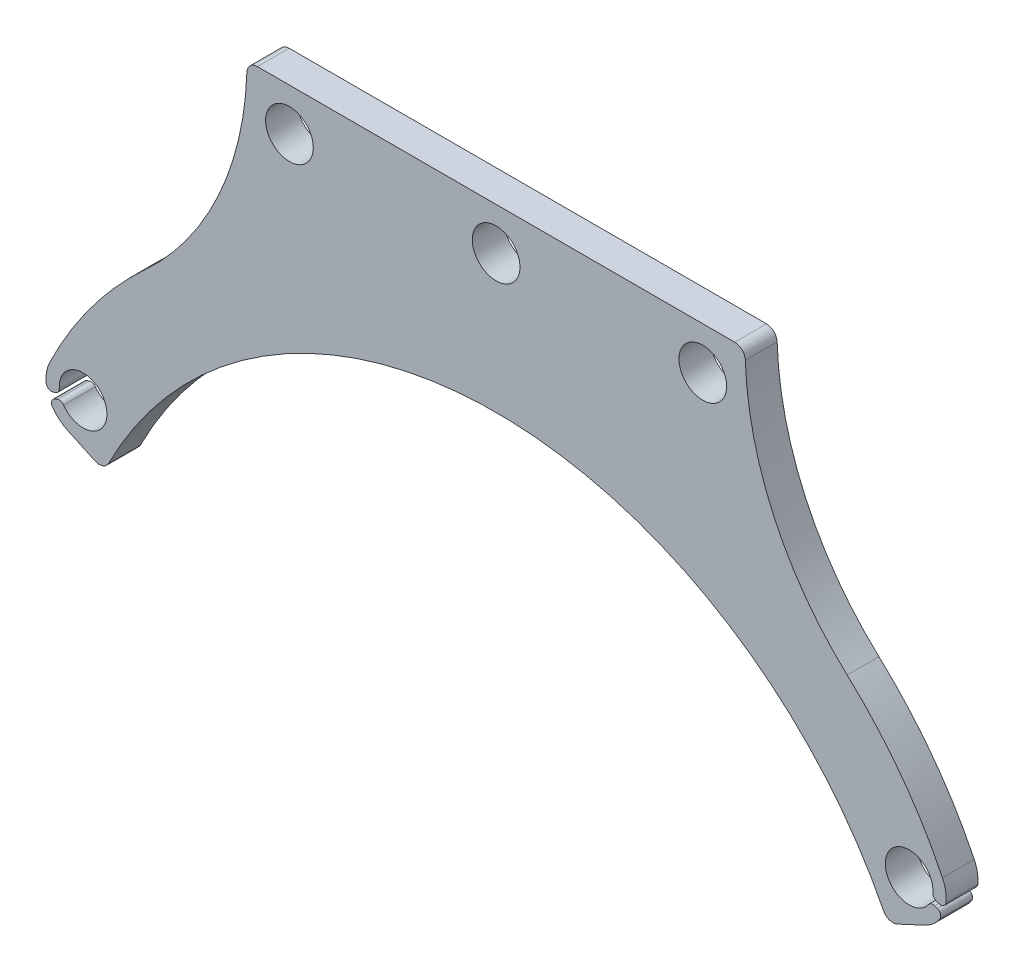
from build123d import *

# Parameters (mm, degrees)
SKETCH_1_R      = 2.25
EXTRUDE_1_DEPTH = 3


with BuildPart() as part:
    # 草图1 → 凸台-拉伸1 (new body)
    with BuildSketch(Plane(origin=(0, 0, 0), x_dir=(-1, 0, 0), z_dir=(0, 0, -1))):
        with BuildLine():
            Line((-41.791952639, -38.236908366), (-41.547911956, -38.150201988))
            ThreePointArc((-41.547911956, -38.150201988), (-41.297660294, -37.953957018), (-41.216368699, -37.646500259))
            ThreePointArc((-41.216368699, -37.646500259), (-36.850985646, -36.746719128), (-40.805488223, -38.802949817))
            ThreePointArc((-40.805488223, -38.802949817), (-41.062544272, -38.615706205), (-41.380516207, -38.621348105))
            Line((-41.380516207, -38.621348105), (-41.62455689, -38.708054482))
            ThreePointArc((-41.62455689, -38.708054482), (-41.932143393, -39.023021663), (-41.871497469, -39.459067365))
            ThreePointArc((-41.871497469, -39.459067365), (-41.243343249, -40.162162054), (-40.450307086, -40.672077255))
            Line((-40.450307086, -40.672077255), (-37.864755045, -41.877739972))
            ThreePointArc((-37.864755045, -41.877739972), (-37.116075694, -41.916780886), (-36.550657336, -41.424493323))
            ThreePointArc((-36.550657336, -41.424493323), (0, -19), (36.550657336, -41.424493323))
            ThreePointArc((36.550657336, -41.424493323), (37.116075694, -41.916780886), (37.864755045, -41.877739972))
            Line((37.864755045, -41.877739972), (40.450307086, -40.672077255))
            ThreePointArc((40.450307086, -40.672077255), (41.243343249, -40.162162054), (41.871497469, -39.459067365))
            ThreePointArc((41.871497469, -39.459067365), (41.932143393, -39.023021663), (41.62455689, -38.708054482))
            Line((41.62455689, -38.708054482), (41.380516207, -38.621348105))
            ThreePointArc((41.380516207, -38.621348105), (41.062544272, -38.615706205), (40.805488223, -38.802949817))
            ThreePointArc((40.805488223, -38.802949817), (36.850985646, -36.746719128), (41.216368699, -37.646500259))
            ThreePointArc((41.216368699, -37.646500259), (41.297660294, -37.953957018), (41.547911956, -38.150201988))
            Line((41.547911956, -38.150201988), (41.791952639, -38.236908366))
            ThreePointArc((41.791952639, -38.236908366), (42.229313556, -38.186617104), (42.457382592, -37.810055957))
            ThreePointArc((42.457382592, -37.810055957), (42.413654712, -36.868245075), (42.120121371, -35.972277417))
            ThreePointArc((42.120121371, -35.972277417), (38.193299638, -29.507864773), (33.125428162, -23.893130722))
            ThreePointArc((33.125428162, -23.893130722), (26.210916767, -14.399107105), (23.515754966, -2.967438148))
            ThreePointArc((23.515754966, -2.967438148), (23.211784398, -2.281473086), (22.516285244, -2))
            Line((22.516285244, -2), (-22.516285244, -2))
            ThreePointArc((-22.516285244, -2), (-23.211784398, -2.281473086), (-23.515754966, -2.967438148))
            ThreePointArc((-23.515754966, -2.967438148), (-26.210916767, -14.399107105), (-33.125428162, -23.893130722))
            ThreePointArc((-33.125428162, -23.893130722), (-38.193299638, -29.507864773), (-42.120121371, -35.972277417))
            ThreePointArc((-42.120121371, -35.972277417), (-42.413654712, -36.868245075), (-42.457382592, -37.810055957))
            ThreePointArc((-42.457382592, -37.810055957), (-42.229313556, -38.186617104), (-41.791952639, -38.236908366))
        make_face()
        with Locations(Location((0, -6, 0), (0, 0, 180))):
            Circle(SKETCH_1_R, mode=Mode.SUBTRACT)
        with Locations(Location((19.5, -6, 0), (0, 0, 180))):
            Circle(SKETCH_1_R, mode=Mode.SUBTRACT)
        with Locations(Location((-19.5, -6, 0), (0, 0, 180))):
            Circle(SKETCH_1_R, mode=Mode.SUBTRACT)
    extrude(amount=-EXTRUDE_1_DEPTH)


solid = part.part
